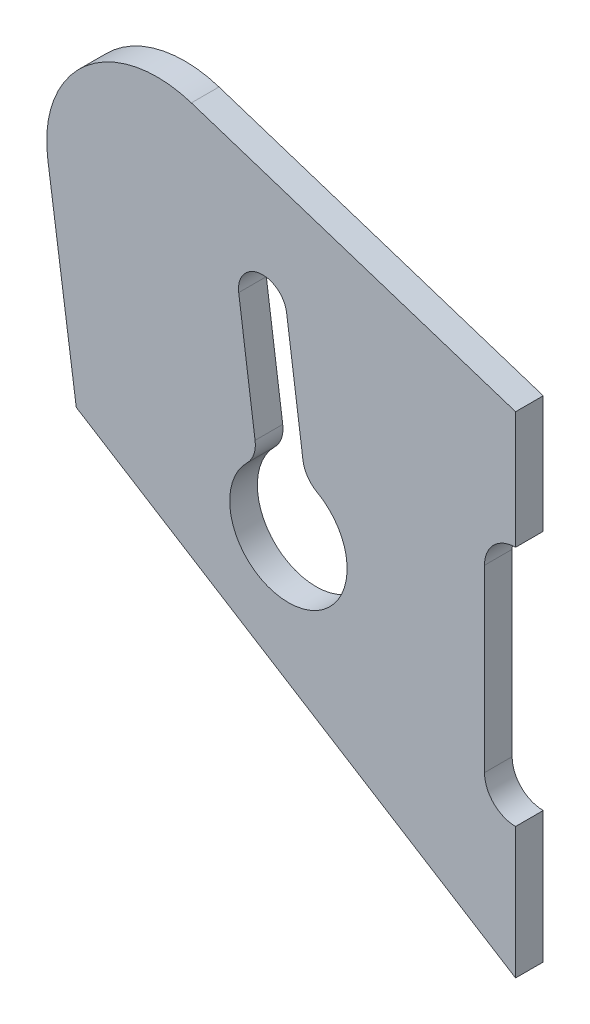
from build123d import *

# Parameters (mm, degrees)
BOSS_EXTRUDE1_DEPTH = 8


with BuildPart() as part:
    # Sketch3 → Boss-Extrude1 (new body)
    with BuildSketch(Plane(origin=(0, 0, 0), x_dir=(0, 1, 0), z_dir=(0, 0, 1))):
        with BuildLine():
            Line((142, -7.927e-06), (172.503565405, 93.880254255))
            ThreePointArc((172.503565405, 93.880254255), (166.569161936, 124.354702778), (137.573040575, 135.451283482))
            Line((137.573040575, 135.451283482), (79.487889635, 127.207214423))
            Line((79.487889635, 127.207214423), (0, 0))
            Line((0, 0), (38, 0))
            ThreePointArc((38, 0), (40.636038969, 6.363961031), (47, 9))
            Line((47, 9), (99, 9))
            ThreePointArc((99, 9), (105.363961031, 6.363961031), (108, 0))
            Line((108, 0), (142, -7.927e-06))
        make_face()
        with BuildLine():
            Line((133.685772252, 66.309558381), (99.009829465, 61.557822716))
            ThreePointArc((99.009829465, 61.557822716), (95.579909701, 60.235336435), (93.103530045, 57.518561996))
            ThreePointArc((93.103530045, 57.518561996), (61.4020571, 63.469747855), (90.333946971, 77.729682935))
            ThreePointArc((90.333946971, 77.729682935), (93.449887854, 75.779238892), (97.109135199, 75.42819983))
            Line((97.109135199, 75.42819983), (131.785077986, 80.179935496))
            ThreePointArc((131.785077986, 80.179935496), (139.670613676, 74.195094072), (133.685772252, 66.309558381))
        make_face(mode=Mode.SUBTRACT)
    extrude(amount=BOSS_EXTRUDE1_DEPTH)


solid = part.part
